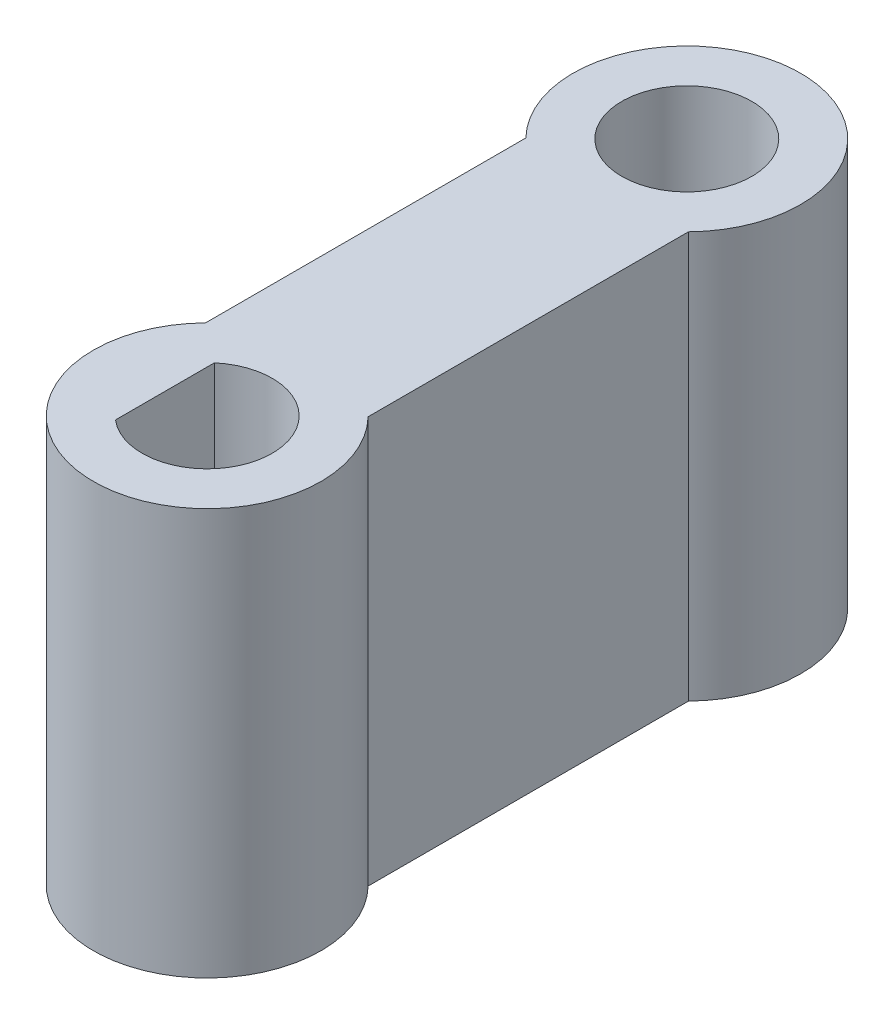
from build123d import *

# Parameters (mm, degrees)
SKETCH1_R           = 2
BOSS_EXTRUDE1_DEPTH = 25
BOSS_EXTRUDE2_START = -25
SKETCH3_R           = 7
SKETCH3_R_2         = 2
BOSS_EXTRUDE2_DEPTH = 25
MOVE_FACE1_BY       = 2
MOVE_FACE1_2_BY     = 2
BOSS_EXTRUDE3_START = -25
BOSS_EXTRUDE3_DEPTH = 25


with BuildPart() as part:
    # Sketch1 → Boss-Extrude1 (new body)
    with BuildSketch(Plane(origin=(0, 0, 0), x_dir=(1, 0, 0), z_dir=(0, 1, 0))):
        with BuildLine():
            Line((-5, 0), (-5, 29.5))
            ThreePointArc((-5, 29.5), (0, 34.5), (5, 29.5))
            Line((5, 29.5), (5, 0))
            ThreePointArc((5, 0), (0, -5), (-5, 0))
        make_face()
        with Locations(Location((0, 29.5, 0), (0, 0, 270))):
            Circle(SKETCH1_R, mode=Mode.SUBTRACT)
        with Locations(Location((0, 0, 0), (0, 0, 270))):
            Circle(SKETCH1_R, mode=Mode.SUBTRACT)
    extrude(amount=BOSS_EXTRUDE1_DEPTH)

    # Sketch3 → Boss-Extrude2 (add)
    # profile 1 of 2: a face of its own
    with BuildSketch(Plane(origin=(0, 25, 0), x_dir=(1, 0, 0), z_dir=(0, 1, 0)).offset(BOSS_EXTRUDE2_START)):
        with Locations((0, 29.5)):
            Circle(SKETCH3_R)
        with Locations(Location((0, 29.5, 0), (0, 0, 270))):
            Circle(SKETCH3_R_2, mode=Mode.SUBTRACT)
    # profile 2 of 2: a face of its own
    with BuildSketch(Plane(origin=(0, 25, 0), x_dir=(1, 0, 0), z_dir=(0, 1, 0)).offset(BOSS_EXTRUDE2_START)):
        Circle(SKETCH3_R)
        with Locations(Location((0, 0, 0), (0, 0, 270))):
            Circle(SKETCH3_R_2, mode=Mode.SUBTRACT)
    extrude(amount=BOSS_EXTRUDE2_DEPTH)

    # Move Face1: a curved face moved inward by 2.0
    add(Solid.thicken(part.faces().sort_by_distance((0, 12.5, -31.5))[0], -MOVE_FACE1_BY), mode=Mode.SUBTRACT)

    # Move Face1 2: a curved face moved inward by 2.0
    add(Solid.thicken(part.faces().sort_by_distance((0, 12.5, -2))[0], -MOVE_FACE1_2_BY), mode=Mode.SUBTRACT)

    # Sketch5 → Boss-Extrude3 (add)
    with BuildSketch(Plane(origin=(0, 25, 0), x_dir=(1, 0, 0), z_dir=(0, 1, 0)).offset(BOSS_EXTRUDE3_START)):
        with BuildLine():
            Line((-2.6, 3.039736831), (-2.6, -3.039736831))
            ThreePointArc((-2.6, -3.039736831), (-4, 0), (-2.6, 3.039736831))
        make_face()
    extrude(amount=BOSS_EXTRUDE3_DEPTH)


solid = part.part
